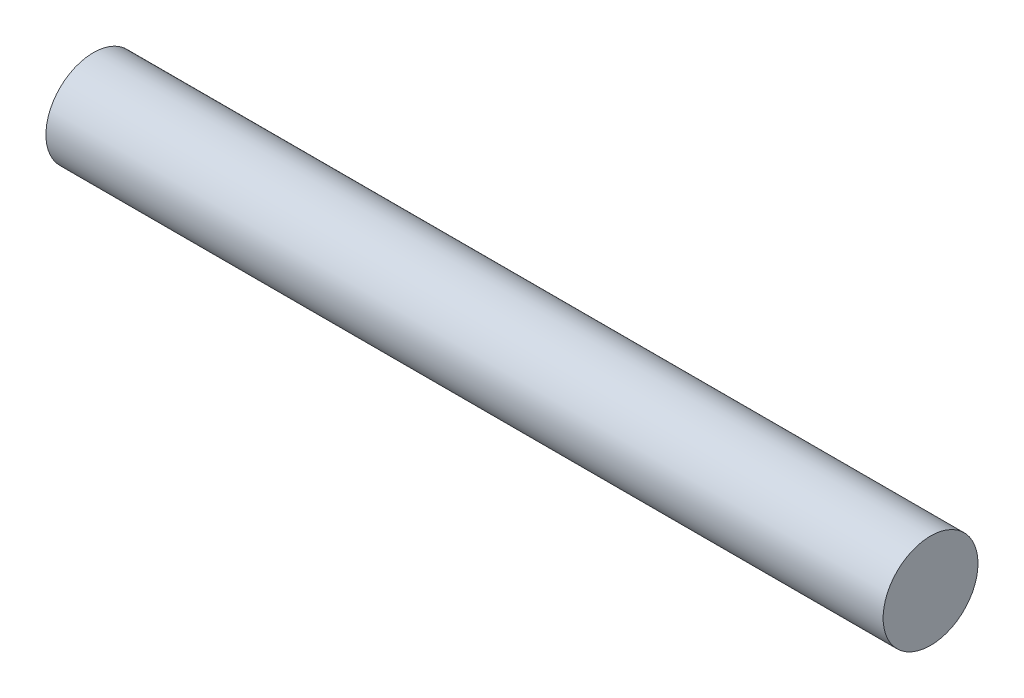
from build123d import *

# Parameters (mm, degrees)
SKETCH1_R           = 8.5
BOSS_EXTRUDE1_DEPTH = 150


with BuildPart() as part:
    # Sketch1 → Boss-Extrude1 (new body)
    with BuildSketch(Plane(origin=(0, 0, 0), x_dir=(0, 0, -1), z_dir=(1, 0, 0))):
        Circle(SKETCH1_R)
    extrude(amount=BOSS_EXTRUDE1_DEPTH)


solid = part.part
